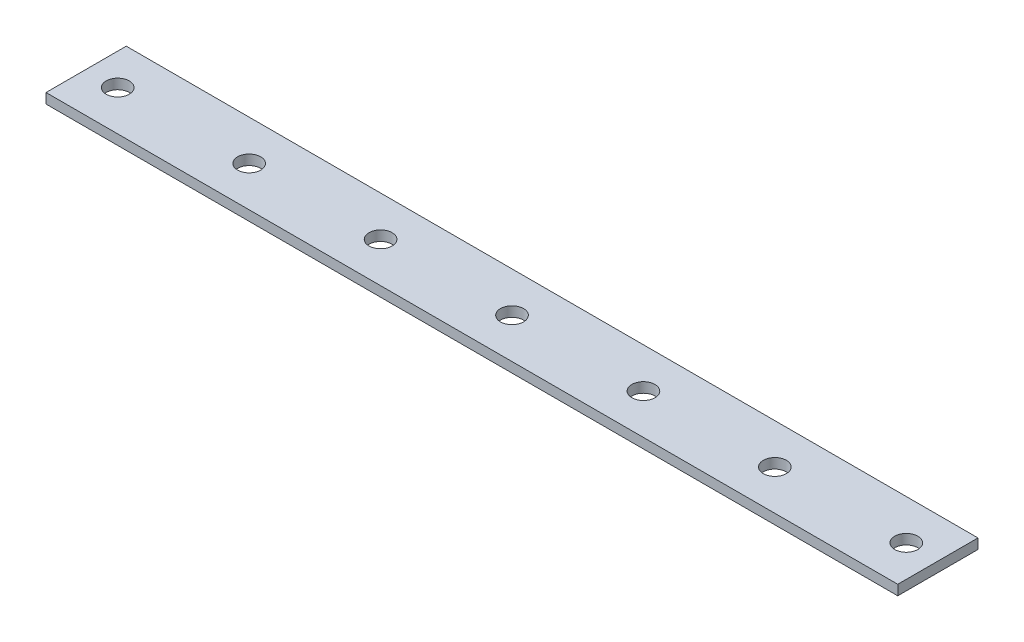
from build123d import *

# Parameters (mm, degrees)
SKETCH1_W           = 134.8
SKETCH1_H           = 12.7
SKETCH1_R           = 1.8288
BOSS_EXTRUDE1_DEPTH = 1.5875
SKETCH2_R           = 1.8288
CUT_EXTRUDE1_DEPTH  = 137.401796749


with BuildPart() as part:
    # Sketch1 → Boss-Extrude1 (new body)
    with BuildSketch(Plane(origin=(0, 0, 0), x_dir=(1, 0, 0), z_dir=(0, 1, 0))):
        with Locations((68.4, 6.35)):
            Rectangle(SKETCH1_W, SKETCH1_H)
        with Locations(Location((6, 6.35, 0), (0, 0, 270))):
            Circle(SKETCH1_R, mode=Mode.SUBTRACT)
        with Locations(Location((130.8, 6.35, 0), (0, 0, 270))):
            Circle(SKETCH1_R, mode=Mode.SUBTRACT)
    extrude(amount=BOSS_EXTRUDE1_DEPTH)

    # Sketch2 → Cut-Extrude1 (cut, through all)
    with BuildSketch(Plane(origin=(0, 1.5875, 0), x_dir=(1, 0, 0), z_dir=(0, 1, 0))):
        with Locations(Location((26.8, 6.35, 0), (0, 0, 270))):
            Circle(SKETCH2_R)
        with Locations(Location((47.6, 6.35, 0), (0, 0, 270))):
            Circle(SKETCH2_R)
        with Locations(Location((68.4, 6.35, 0), (0, 0, 270))):
            Circle(SKETCH2_R)
        with Locations(Location((89.2, 6.35, 0), (0, 0, 270))):
            Circle(SKETCH2_R)
        with Locations(Location((110, 6.35, 0), (0, 0, 270))):
            Circle(SKETCH2_R)
    extrude(amount=-CUT_EXTRUDE1_DEPTH, mode=Mode.SUBTRACT)


solid = part.part
